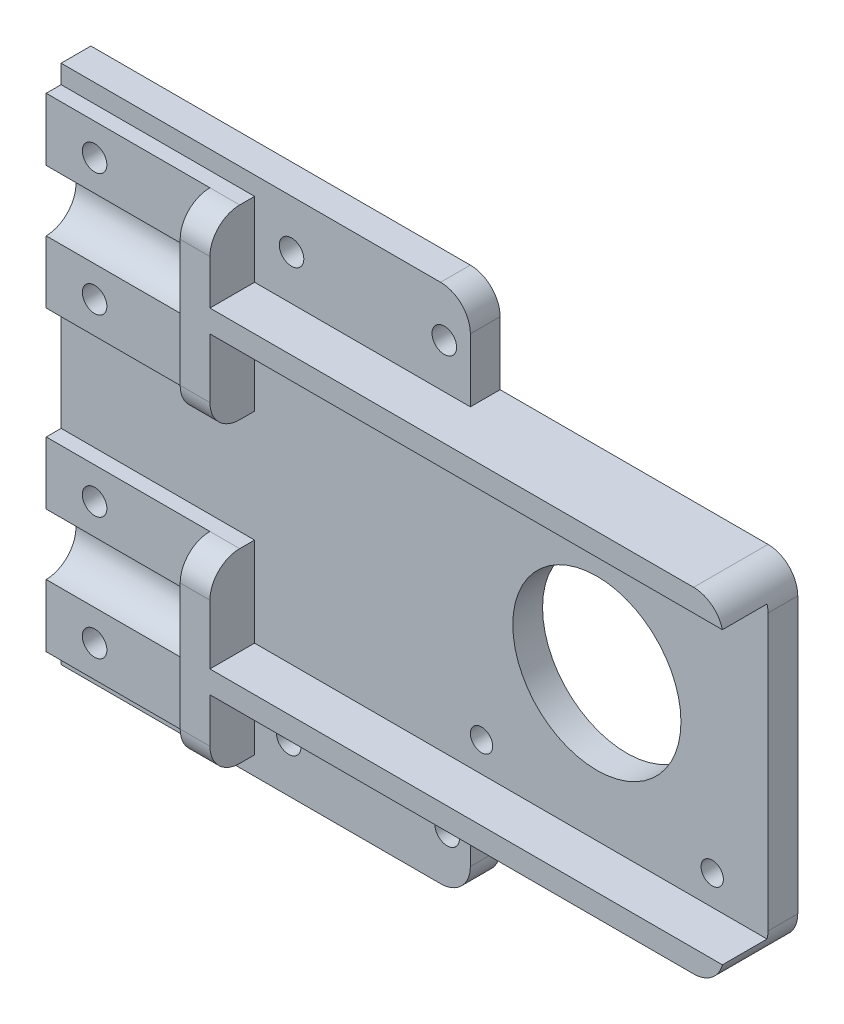
from build123d import *

# Parameters (mm, degrees)
SKETCH1_W               = 55
SKETCH1_H               = 70
BOSS_EXTRUDE1_DEPTH     = 4
SKETCH4_W               = 26
SKETCH4_H               = 25
BOSS_EXTRUDE2_DEPTH     = 2
SKETCH3_R               = 4.1
CUT_EXTRUDE1_DEPTH      = 22
SKETCH5_W               = 40
SKETCH5_H               = 45
BOSS_EXTRUDE3_DEPTH     = 4
SKETCH7_R               = 11.3
SKETCH7_R_2             = 1.5
CUT_EXTRUDE2_DEPTH      = 77.270898775
FILLET1_R               = 4
SKETCH8_W               = 4
SKETCH8_H               = 25
BOSS_EXTRUDE4_DEPTH     = 4
FILLET2_R               = 4
SKETCH10_W              = 69
SKETCH10_H              = 3
BOSS_EXTRUDE5_DEPTH     = 6
CUT_EXTRUDE4_DEPTH      = 77.270898775
CUT_EXTRUDE4_DEPTH_BACK = 77.270898775
SKETCH12_R              = 1.65
CUT_EXTRUDE5_DEPTH      = 77.689308251
CUT_EXTRUDE5_DEPTH_BACK = 77.689308251
SKETCH13_R              = 1.65
FILLET3_R               = 4


with BuildPart() as part:
    # Sketch1 → Boss-Extrude1 (new body)
    with BuildSketch(Plane.XY):
        Rectangle(SKETCH1_W, SKETCH1_H)
    extrude(amount=BOSS_EXTRUDE1_DEPTH)

    # Sketch4 → Boss-Extrude2 (add)
    with BuildSketch(Plane.XY.offset(4)):
        with Locations((-14.5, 20)):
            Rectangle(SKETCH4_W, SKETCH4_H)
        with Locations((-14.5, -20)):
            Rectangle(SKETCH4_W, SKETCH4_H)
    extrude(amount=BOSS_EXTRUDE2_DEPTH)

    # Sketch3 → Cut-Extrude1 (cut)
    with BuildSketch(Plane.ZY.offset(27.5)):
        with Locations((6.1, 20)):
            Circle(SKETCH3_R)
        with Locations((6.1, -20)):
            Circle(SKETCH3_R)
    extrude(amount=-CUT_EXTRUDE1_DEPTH, mode=Mode.SUBTRACT)

    # Sketch5 → Boss-Extrude3 (add)
    with BuildSketch(Plane.XY.offset(4)):
        with Locations((47.5, 0)):
            Rectangle(SKETCH5_W, SKETCH5_H)
    extrude(amount=-BOSS_EXTRUDE3_DEPTH)

    # Sketch7 → Cut-Extrude2 (cut, through all)
    with BuildSketch(Plane(origin=(0, 0, 0), x_dir=(-1, 0, 0), z_dir=(0, 0, -1))):
        with Locations((-44.5, 0)):
            Circle(SKETCH7_R)
        with Locations((-60, 15.5)):
            Circle(SKETCH7_R_2)
        with Locations((-29, 15.5)):
            Circle(SKETCH7_R_2)
        with Locations((-29, -15.5)):
            Circle(SKETCH7_R_2)
        with Locations((-60, -15.5)):
            Circle(SKETCH7_R_2)
    extrude(amount=-CUT_EXTRUDE2_DEPTH, mode=Mode.SUBTRACT)

    # Fillet1
    fillet1_edges = [part.edges().sort_by_distance(p)[0] for p in [
        (27.5, -35, 2),
        (27.5, 35, 2),
    ]]
    fillet(fillet1_edges, radius=FILLET1_R)

    # Sketch8 → Boss-Extrude4 (add)
    with BuildSketch(Plane.XY.offset(6)):
        with Locations((-3.5, 20)):
            Rectangle(SKETCH8_W, SKETCH8_H)
        with Locations((-3.5, -20)):
            Rectangle(SKETCH8_W, SKETCH8_H)
    extrude(amount=BOSS_EXTRUDE4_DEPTH)

    # Fillet2
    fillet2_edges = [part.edges().sort_by_distance(p)[0] for p in [
        (-3.5, -32.5, 10),
        (-3.5, -7.5, 10),
        (-3.5, 32.5, 10),
        (-3.5, 7.5, 10),
    ]]
    fillet(fillet2_edges, radius=FILLET2_R)

    # Sketch10 → Boss-Extrude5 (add)
    with BuildSketch(Plane.XY.offset(4)):
        with Locations((33, 21)):
            Rectangle(SKETCH10_W, SKETCH10_H)
        with Locations((33, -21)):
            Rectangle(SKETCH10_W, SKETCH10_H)
    extrude(amount=BOSS_EXTRUDE5_DEPTH)

    # Sketch12 → Cut-Extrude4 (cut, two sides: drawn at the far end of the back side and taken through both)
    with BuildSketch(Plane.XY.offset(4).offset(-CUT_EXTRUDE4_DEPTH_BACK)):
        with Locations((3.466076719, 28.5)):
            Circle(SKETCH12_R)
        with Locations((24, 28.5)):
            Circle(SKETCH12_R)
        with Locations((24.385, -28.5)):
            Circle(SKETCH12_R)
        with Locations((3.081076719, -28.5)):
            Circle(SKETCH12_R)
    extrude(amount=CUT_EXTRUDE4_DEPTH + CUT_EXTRUDE4_DEPTH_BACK, mode=Mode.SUBTRACT)

    # Sketch13 → Cut-Extrude5 (cut, two sides: drawn at the far end of the back side and taken through both)
    with BuildSketch(Plane(origin=(0, 0, 0), x_dir=(-1, 0, 0), z_dir=(0, 0, -1)).offset(-CUT_EXTRUDE5_DEPTH_BACK)):
        with Locations(Location((21, -11.761910465, 0), (0, 0, 180))):
            Circle(SKETCH13_R)
        with Locations(Location((21, -28.238089535, 0), (0, 0, 180))):
            Circle(SKETCH13_R)
        with Locations((21, 28.238089535)):
            Circle(SKETCH13_R)
        with Locations((21, 11.761910465)):
            Circle(SKETCH13_R)
    extrude(amount=CUT_EXTRUDE5_DEPTH + CUT_EXTRUDE5_DEPTH_BACK, mode=Mode.SUBTRACT)

    # Fillet3
    fillet3_edges = [part.edges().sort_by_distance(p)[0] for p in [
        (67.5, 22.5, 5),
        (67.5, -22.5, 5),
    ]]
    fillet(fillet3_edges, radius=FILLET3_R)


solid = part.part
